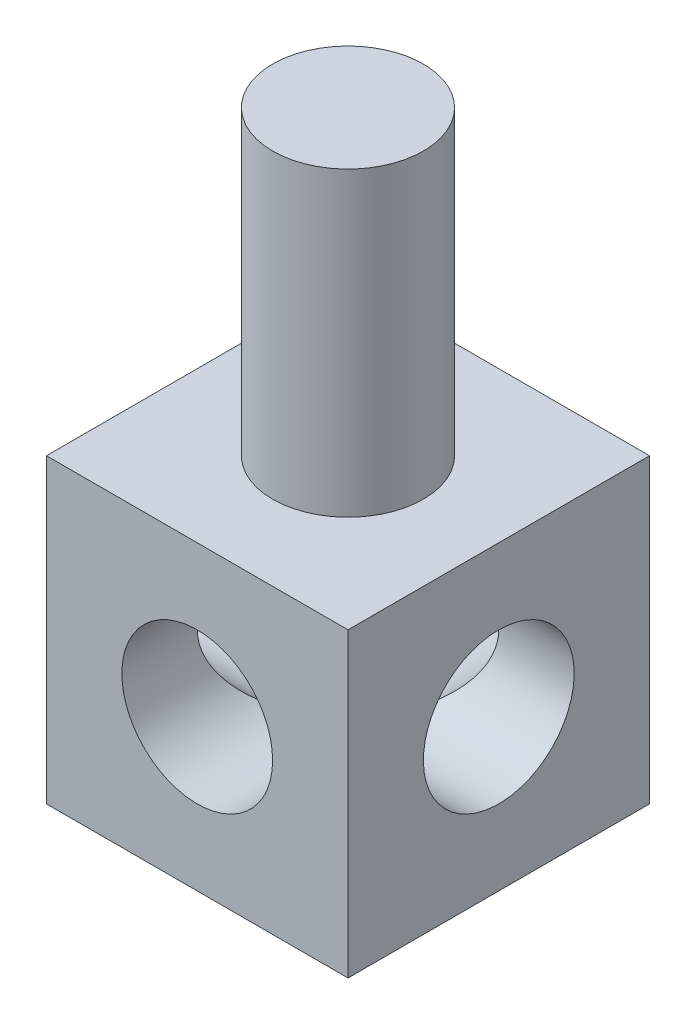
from build123d import *

# Parameters (mm, degrees)
SKETCH1_W           = 10
SKETCH1_H           = 10
BOSS_EXTRUDE1_DEPTH = 10
SKETCH2_R           = 2.5
BOSS_EXTRUDE2_DEPTH = 10
SKETCH3_R           = 2.5
CUT_EXTRUDE1_DEPTH  = 10
SKETCH4_R           = 2.5
CUT_EXTRUDE2_DEPTH  = 10


with BuildPart() as part:
    # Sketch1 → Boss-Extrude1 (new body)
    with BuildSketch(Plane.XY):
        with Locations((5, 5)):
            Rectangle(SKETCH1_W, SKETCH1_H)
    extrude(amount=BOSS_EXTRUDE1_DEPTH)

    # Sketch2 → Boss-Extrude2 (add)
    with BuildSketch(Plane(origin=(0, 10, 0), x_dir=(1, 0, 0), z_dir=(0, 1, 0))):
        with Locations(Location((5, -5, 0), (0, 0, 270))):
            Circle(SKETCH2_R)
    extrude(amount=BOSS_EXTRUDE2_DEPTH)

    # Sketch3 → Cut-Extrude1 (cut)
    with BuildSketch(Plane.XY.offset(10)):
        with Locations((5, 5)):
            Circle(SKETCH3_R)
    extrude(amount=-CUT_EXTRUDE1_DEPTH, mode=Mode.SUBTRACT)

    # Sketch4 → Cut-Extrude2 (cut)
    with BuildSketch(Plane(origin=(10, 0, 0), x_dir=(0, 0, -1), z_dir=(1, 0, 0))):
        with Locations(Location((-5, 5, 0), (0, 0, 90))):
            Circle(SKETCH4_R)
    extrude(amount=-CUT_EXTRUDE2_DEPTH, mode=Mode.SUBTRACT)


solid = part.part
